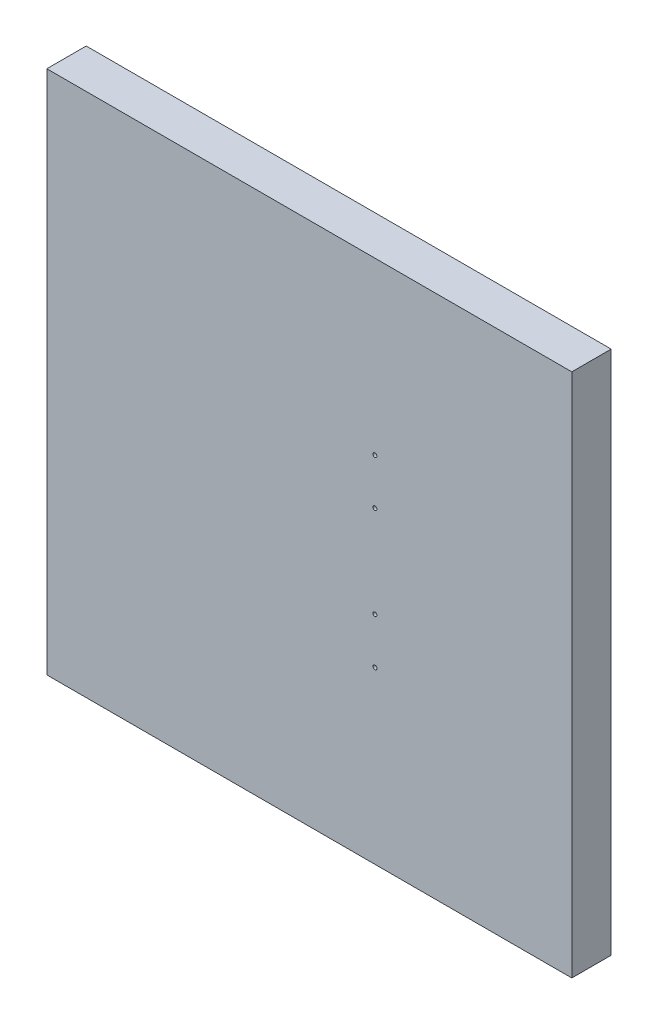
from build123d import *

# Parameters (mm, degrees)
ESQUISSE1_W                          = 400
ESQUISSE1_H                          = 400
EXTRUSION1_DEPTH                     = 30
ESQUISSE4_W                          = 1.5
ESQUISSE4_H                          = 30
TROU_TARAUD_M32_AT_2_COUNT           = 2
TROU_TARAUD_M32_AT_2_PITCH           = 408.679576779
TROU_TARAUD_M32_AT_3_COUNT           = 2
TROU_TARAUD_M32_AT_3_PITCH           = 332.592834859
R_P_TITION_LIN_AIRE1_COUNT           = 5
R_P_TITION_LIN_AIRE1_PITCH           = 35
R_P_TITION_LIN_AIRE1_COPY_1_SKETCH_W = 1.5
R_P_TITION_LIN_AIRE1_COPY_1_SKETCH_H = 30
R_P_TITION_LIN_AIRE1_COPY_2_SKETCH_W = 1.5
R_P_TITION_LIN_AIRE1_COPY_2_SKETCH_H = 30
R_P_TITION_LIN_AIRE1_COPY_3_SKETCH_W = 1.5
R_P_TITION_LIN_AIRE1_COPY_3_SKETCH_H = 30
R_P_TITION_LIN_AIRE1_COPY_4_SKETCH_W = 1.5
R_P_TITION_LIN_AIRE1_COPY_4_SKETCH_H = 30
R_P_TITION_LIN_AIRE1_COPY_5_SKETCH_W = 1.5
R_P_TITION_LIN_AIRE1_COPY_5_SKETCH_H = 30
R_P_TITION_LIN_AIRE1_COPY_6_SKETCH_W = 1.5
R_P_TITION_LIN_AIRE1_COPY_6_SKETCH_H = 30


with BuildPart() as part:
    # Esquisse1 → Extrusion1 (new body)
    with BuildSketch(Plane.XY):
        Rectangle(ESQUISSE1_W, ESQUISSE1_H)
    extrude(amount=EXTRUSION1_DEPTH)

    # Esquisse4 → Trou taraudé M32 (revolve, cut)
    with BuildSketch(Plane(origin=(50, 70, 30), x_dir=(0, -1, 0), z_dir=(1, 0, 0))):
        with Locations((0.75, 15)):
            Rectangle(ESQUISSE4_W, ESQUISSE4_H)
    trou_taraud_m32 = revolve(axis=Axis((50, 70, 36.35), (0, 0, -1)), mode=Mode.SUBTRACT)

    # Trou taraudé M32 at 2: Trou taraudé M32 ×2
    with Locations(*[Vector(-0.8014096921823338, -0.5981157958758629, 0) * (i * TROU_TARAUD_M32_AT_2_PITCH) for i in range(1, TROU_TARAUD_M32_AT_2_COUNT)]):
        add(trou_taraud_m32, mode=Mode.SUBTRACT)

    # Trou taraudé M32 at 3: Trou taraudé M32 ×2
    with Locations(*[Vector(-0.8119019030947789, -0.5837938846468643, 0) * (i * TROU_TARAUD_M32_AT_3_PITCH) for i in range(1, TROU_TARAUD_M32_AT_3_COUNT)]):
        add(trou_taraud_m32, mode=Mode.SUBTRACT)

    # Répétition linéaire1: Trou taraudé M32 ×5, 1 skipped
    with Locations(*[(0, -i * R_P_TITION_LIN_AIRE1_PITCH, 0) for i in range(1, R_P_TITION_LIN_AIRE1_COUNT) if i not in (2,)]):
        add(trou_taraud_m32, mode=Mode.SUBTRACT)

    # Répétition linéaire1 copy 1 sketch → Répétition linéaire1 copy 1 (revolve, cut)
    with BuildSketch(Plane(origin=(-277.519773828, -209.437710323, 30), x_dir=(0, -1, 0), z_dir=(1, 0, 0))):
        with Locations((0.75, 15)):
            Rectangle(R_P_TITION_LIN_AIRE1_COPY_1_SKETCH_W, R_P_TITION_LIN_AIRE1_COPY_1_SKETCH_H)
    revolve(axis=Axis((-277.519773828, -209.437710323, 36.35), (0, 0, -1)), mode=Mode.SUBTRACT)

    # Répétition linéaire1 copy 2 sketch → Répétition linéaire1 copy 2 (revolve, cut)
    with BuildSketch(Plane(origin=(-277.519773828, -279.437710323, 30), x_dir=(0, -1, 0), z_dir=(1, 0, 0))):
        with Locations((0.75, 15)):
            Rectangle(R_P_TITION_LIN_AIRE1_COPY_2_SKETCH_W, R_P_TITION_LIN_AIRE1_COPY_2_SKETCH_H)
    revolve(axis=Axis((-277.519773828, -279.437710323, 36.35), (0, 0, -1)), mode=Mode.SUBTRACT)

    # Répétition linéaire1 copy 3 sketch → Répétition linéaire1 copy 3 (revolve, cut)
    with BuildSketch(Plane(origin=(-277.519773828, -314.437710323, 30), x_dir=(0, -1, 0), z_dir=(1, 0, 0))):
        with Locations((0.75, 15)):
            Rectangle(R_P_TITION_LIN_AIRE1_COPY_3_SKETCH_W, R_P_TITION_LIN_AIRE1_COPY_3_SKETCH_H)
    revolve(axis=Axis((-277.519773828, -314.437710323, 36.35), (0, 0, -1)), mode=Mode.SUBTRACT)

    # Répétition linéaire1 copy 4 sketch → Répétition linéaire1 copy 4 (revolve, cut)
    with BuildSketch(Plane(origin=(-220.032755578, -159.165663068, 30), x_dir=(0, -1, 0), z_dir=(1, 0, 0))):
        with Locations((0.75, 15)):
            Rectangle(R_P_TITION_LIN_AIRE1_COPY_4_SKETCH_W, R_P_TITION_LIN_AIRE1_COPY_4_SKETCH_H)
    revolve(axis=Axis((-220.032755578, -159.165663068, 36.35), (0, 0, -1)), mode=Mode.SUBTRACT)

    # Répétition linéaire1 copy 5 sketch → Répétition linéaire1 copy 5 (revolve, cut)
    with BuildSketch(Plane(origin=(-220.032755578, -229.165663068, 30), x_dir=(0, -1, 0), z_dir=(1, 0, 0))):
        with Locations((0.75, 15)):
            Rectangle(R_P_TITION_LIN_AIRE1_COPY_5_SKETCH_W, R_P_TITION_LIN_AIRE1_COPY_5_SKETCH_H)
    revolve(axis=Axis((-220.032755578, -229.165663068, 36.35), (0, 0, -1)), mode=Mode.SUBTRACT)

    # Répétition linéaire1 copy 6 sketch → Répétition linéaire1 copy 6 (revolve, cut)
    with BuildSketch(Plane(origin=(-220.032755578, -264.165663068, 30), x_dir=(0, -1, 0), z_dir=(1, 0, 0))):
        with Locations((0.75, 15)):
            Rectangle(R_P_TITION_LIN_AIRE1_COPY_6_SKETCH_W, R_P_TITION_LIN_AIRE1_COPY_6_SKETCH_H)
    revolve(axis=Axis((-220.032755578, -264.165663068, 36.35), (0, 0, -1)), mode=Mode.SUBTRACT)


solid = part.part
